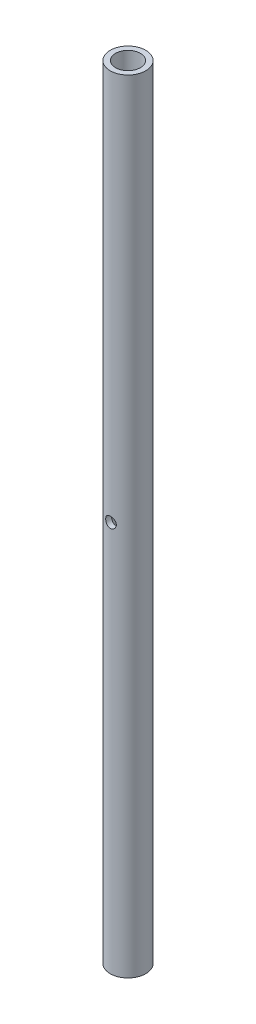
from build123d import *

# Parameters (mm, degrees)
IZIM1_R                     = 5
IZIM1_R_2                   = 3.5
Y_KSEKLIK_EKSTR_ZYON1_DEPTH = 220
IZIM2_R                     = 1.5
KES_EKSTR_ZYON1_DEPTH       = 15


with BuildPart() as part:
    # Çizim1 → Yükseklik-Ekstrüzyon1 (new body)
    with BuildSketch(Plane(origin=(0, 0, 0), x_dir=(1, 0, 0), z_dir=(0, 1, 0))):
        with Locations(Location((0, 0, 0), (0, 0, 270))):
            Circle(IZIM1_R)
        with Locations(Location((0, 0, 0), (0, 0, 270))):
            Circle(IZIM1_R_2, mode=Mode.SUBTRACT)
    extrude(amount=Y_KSEKLIK_EKSTR_ZYON1_DEPTH)

    # Çizim2 → Kes-Ekstrüzyon1 (cut, symmetric)
    with BuildSketch(Plane.XY):
        with Locations((0, 110)):
            Circle(IZIM2_R)
    extrude(amount=KES_EKSTR_ZYON1_DEPTH, both=True, mode=Mode.SUBTRACT)


solid = part.part
